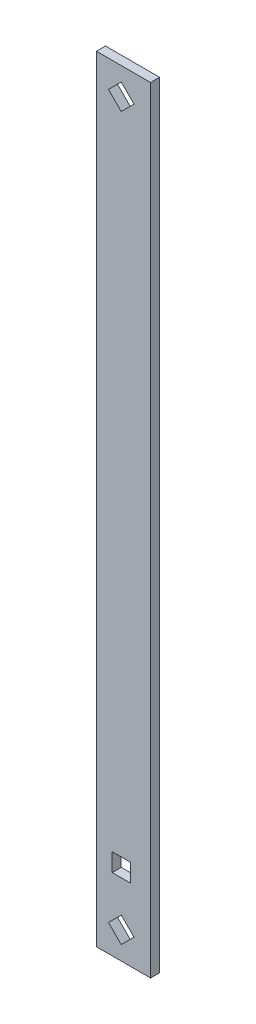
from build123d import *

# Parameters (mm, degrees)
PROFILE_SKETCH_W                  = 6
PROFILE_SKETCH_H                  = 1
PROFILE_EXTRUDE_DEPTH             = 86
FIDUCIAL_CUT_DEPTH                = 88.637808783
FIDUCIAL_1_INDICATOR_SKETCH_W     = 2
FIDUCIAL_1_INDICATOR_SKETCH_H     = 2
INDICATOR_OF_FIDUCIAL_1_CUT_DEPTH = 88.637808783


with BuildPart() as part:
    # Profile Sketch → Profile Extrude (new body)
    with BuildSketch(Plane(origin=(-13.83405858, 0, -105.75669297), x_dir=(-1, 0, 0), z_dir=(0, 1, 0))):
        with Locations((0, 0.5)):
            Rectangle(PROFILE_SKETCH_W, PROFILE_SKETCH_H)
    extrude(amount=PROFILE_EXTRUDE_DEPTH)

    # Fiducial Sketch → Fiducial Cut (cut, through all)
    with BuildSketch(Plane.XY.offset(-104.75669297)):
        Polygon((-12.669845017, 3), (-14.08405858, 4.414213562), (-15.498272142, 3), (-14.08405858, 1.585786438), align=None)
    fiducial_cut = extrude(amount=-FIDUCIAL_CUT_DEPTH, mode=Mode.SUBTRACT)

    # Fiducial Mirror: Fiducial Cut across plane
    add(fiducial_cut.mirror(Plane(origin=(0, 43, 0), x_dir=(0, 0, 1), z_dir=(0, -1, 0))), mode=Mode.SUBTRACT)

    # Fiducial 1 Indicator Sketch → Indicator of Fiducial 1 Cut (cut, through all)
    with BuildSketch(Plane.XY.offset(-104.75669297)):
        with Locations((-14.08405858, 9)):
            Rectangle(FIDUCIAL_1_INDICATOR_SKETCH_W, FIDUCIAL_1_INDICATOR_SKETCH_H)
    extrude(amount=-INDICATOR_OF_FIDUCIAL_1_CUT_DEPTH, mode=Mode.SUBTRACT)


solid = part.part
